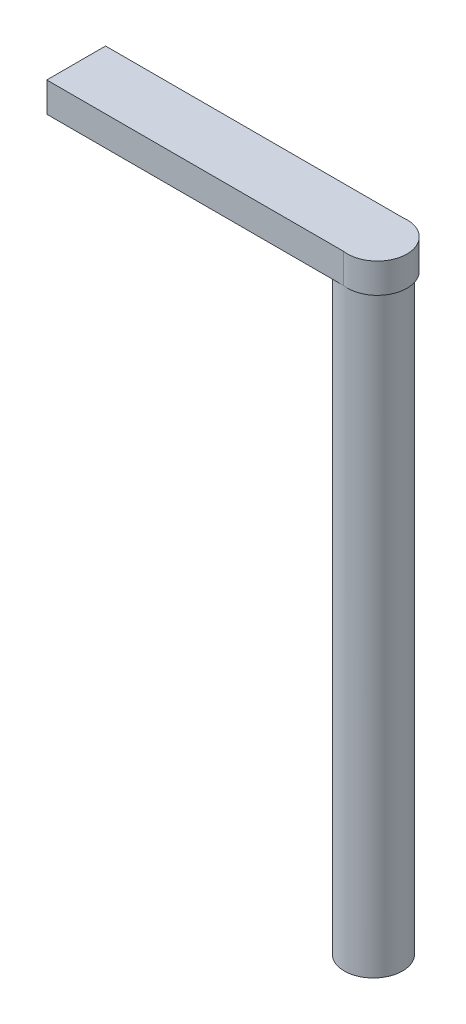
from build123d import *

# Parameters (mm, degrees)
SKETCH1_R           = 4.9
BOSS_EXTRUDE1_DEPTH = 100
BOSS_EXTRUDE2_DEPTH = 5


with BuildPart() as part:
    # Sketch1 → Boss-Extrude1 (new body)
    with BuildSketch(Plane(origin=(0, 0, 0), x_dir=(1, 0, 0), z_dir=(0, 1, 0))):
        with Locations(Location((0, 0, 0), (0, 0, 270))):
            Circle(SKETCH1_R)
    extrude(amount=BOSS_EXTRUDE1_DEPTH)

    # Sketch2 → Boss-Extrude2 (add)
    with BuildSketch(Plane(origin=(0, 100, 0), x_dir=(1, 0, 0), z_dir=(0, 1, 0))):
        with BuildLine():
            Line((0, 4.9), (-50, 4.9))
            Line((-50, 4.9), (-50, -5))
            Line((-50, -5), (0, -5))
            ThreePointArc((0, -5), (5.705336799, -0.05), (0, 4.9))
        make_face()
    extrude(amount=BOSS_EXTRUDE2_DEPTH)


solid = part.part
